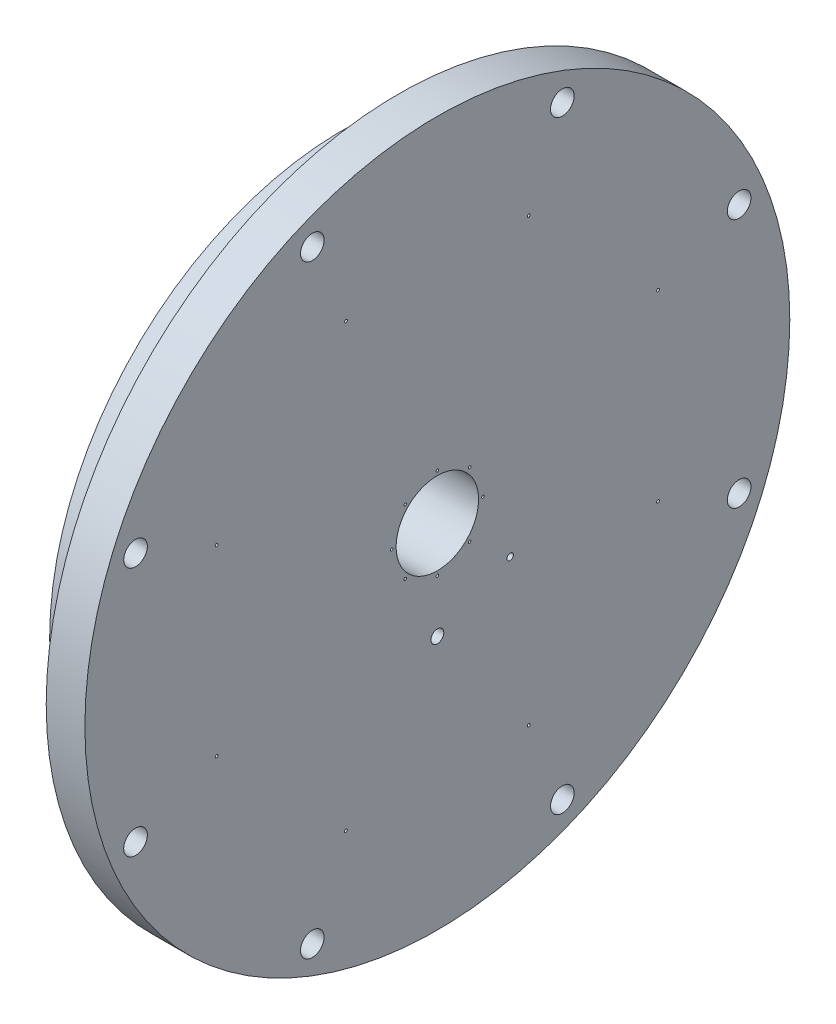
from build123d import *

# Parameters (mm, degrees)
FUEL_RING_SKETCH_W                = 6.7
FUEL_RING_SKETCH_H                = 2.5
CORE_MANIFOLD_SKETCH_W            = 6.7
CORE_MANIFOLD_SKETCH_H            = 1.6
FILM_MANIFOLD_SKETCH_W            = 2.8
FILM_MANIFOLD_SKETCH_H            = 1.5
PINTLE_SEAL_GROOVE_SKETCH_W       = 1.3
PINTLE_SEAL_GROOVE_SKETCH_H       = 2.4
FEED_PASSAGE_SKETCH_W             = 1.5
FEED_PASSAGE_SKETCH_H             = 48.905135707
FEED_PASSAGES_X3_COUNT            = 3
ETHANOL_HOLE_SKETCH_R             = 0.303840419
ETHANOL_HOLE_DEPTH                = 1.8
ETHANOL_HOLES_X8_COUNT            = 8
FILM_HOLE_SKETCH_R                = 0.333416852
FILM_HOLE_DEPTH                   = 1.8
FILM_HOLES_X8_COUNT               = 8
BOLT_HOLE_SKETCH_R                = 2.75
BOLT_HOLE_DEPTH                   = 9
BOLT_HOLES_X8_COUNT               = 8
IGNITER_PORT_4_ORB_SKETCH_R       = 4.953
IGNITER_PORT_4_ORB_DEPTH          = 10.5
IGNITER_PASSAGE_SKETCH_R          = 1.5
IGNITER_PASSAGE_DEPTH             = 22.5
PC_TAP_PORT_4_ORB_SKETCH_R        = 4.953
PC_TAP_PORT_4_ORB_DEPTH           = 10.5
PC_TAP_PASSAGE_SKETCH_R           = 0.75
PC_TAP_PASSAGE_DEPTH              = 22.5
ETHANOL_INLET_PORT_4_ORB_SKETCH_R = 4.953
ETHANOL_INLET_PORT_4_ORB_DEPTH    = 10.5
ETHANOL_INLET_PASSAGE_SKETCH_R    = 2
ETHANOL_INLET_PASSAGE_DEPTH       = 15.2
FILM_RESTRICTOR_SKETCH_R          = 0.434454496
FILM_RESTRICTOR_DEPTH             = 18.16
PINTLE_BOLT_TAP_DRILL_M4_SKETCH_R = 1.65
PINTLE_BOLT_TAP_DRILL_M4_DEPTH    = 10
PINTLE_BOLT_HOLES_X2_COUNT        = 2
TORCH_ETHANOL_PORT_SKETCH_R       = 3.5
TORCH_ETHANOL_PORT_DEPTH          = 8.6
TORCH_ETHANOL_DRILLING_SKETCH_R   = 1
TORCH_ETHANOL_DRILLING_DEPTH      = 15.2


with BuildPart() as part:
    # Body Sketch → Body (revolve)
    with BuildSketch(Plane.XY, mode=Mode.PRIVATE) as body_sk:
        Polygon((0, 9.594864293), (0, 82), (-9, 82), (-9, 68.2), (-22, 68.2), (-22, 9.594864293), align=None)
    revolve(body_sk.sketch.rotate(Axis((-60, 0, 0), (1, 0, 0)), 90), axis=Axis((-60, 0, 0), (1, 0, 0)))

    # Fuel Ring Sketch → Fuel Ring (revolve, cut)
    with BuildSketch(Plane.XY, mode=Mode.PRIVATE) as fuel_ring_sk:
        with Locations((-4.95, 59.9)):
            Rectangle(FUEL_RING_SKETCH_W, FUEL_RING_SKETCH_H)
    revolve(fuel_ring_sk.sketch.rotate(Axis((-60, 0, 0), (1, 0, 0)), 90), axis=Axis((-60, 0, 0), (1, 0, 0)), mode=Mode.SUBTRACT)

    # Core Manifold Sketch → Core Manifold (revolve, cut)
    with BuildSketch(Plane.XY, mode=Mode.PRIVATE) as core_manifold_sk:
        with Locations((-4.95, 10.994864293)):
            Rectangle(CORE_MANIFOLD_SKETCH_W, CORE_MANIFOLD_SKETCH_H)
    revolve(core_manifold_sk.sketch.rotate(Axis((-60, 0, 0), (1, 0, 0)), 90), axis=Axis((-60, 0, 0), (1, 0, 0)), mode=Mode.SUBTRACT)

    # Film Manifold Sketch → Film Manifold (revolve, cut)
    with BuildSketch(Plane.XY, mode=Mode.PRIVATE) as film_manifold_sk:
        with Locations((-3, 55.56918576)):
            Rectangle(FILM_MANIFOLD_SKETCH_W, FILM_MANIFOLD_SKETCH_H)
    revolve(film_manifold_sk.sketch.rotate(Axis((-60, 0, 0), (1, 0, 0)), 90), axis=Axis((-60, 0, 0), (1, 0, 0)), mode=Mode.SUBTRACT)

    # Pintle Seal Groove Sketch → Pintle Seal Groove (revolve, cut)
    with BuildSketch(Plane.XY, mode=Mode.PRIVATE) as pintle_seal_groove_sk:
        with Locations((-21.35, 12.4)):
            Rectangle(PINTLE_SEAL_GROOVE_SKETCH_W, PINTLE_SEAL_GROOVE_SKETCH_H)
    revolve(pintle_seal_groove_sk.sketch.rotate(Axis((-60, 0, 0), (1, 0, 0)), 90), axis=Axis((-60, 0, 0), (1, 0, 0)), mode=Mode.SUBTRACT)

    # Feed Passage Sketch → Feed Passage (revolve, cut)
    with BuildSketch(Plane.XY, mode=Mode.PRIVATE) as feed_passage_sk:
        with Locations((-6.05, 35.447432147)):
            Rectangle(FEED_PASSAGE_SKETCH_W, FEED_PASSAGE_SKETCH_H)
    feed_passage = revolve(feed_passage_sk.sketch.rotate(Axis((-6.8, 0, 0), (0, 1, 0)), 180), axis=Axis((-6.8, 0, 0), (0, 1, 0)), mode=Mode.SUBTRACT)

    # Feed Passages x3: Feed Passage ×3 about axis
    feed_passages_x3_axis = Axis((1.1, 0, 0), (-1, 0, 0))
    for i in range(1, FEED_PASSAGES_X3_COUNT):
        add(feed_passage.rotate(feed_passages_x3_axis, i * 360 / FEED_PASSAGES_X3_COUNT), mode=Mode.SUBTRACT)

    # Ethanol Hole Sketch → Ethanol Hole (cut)
    with BuildSketch(Plane(origin=(0, 0, 0), x_dir=(0, 0, -1), z_dir=(1, 0, 0))):
        with Locations((0, 10.598704712)):
            Circle(ETHANOL_HOLE_SKETCH_R)
    ethanol_hole = extrude(amount=-ETHANOL_HOLE_DEPTH, mode=Mode.SUBTRACT)

    # Ethanol Holes x8: Ethanol Hole ×8 about axis
    ethanol_holes_x8_axis = Axis((0, 0, 0), (1, 0, 0))
    for i in range(1, ETHANOL_HOLES_X8_COUNT):
        add(ethanol_hole.rotate(ethanol_holes_x8_axis, i * 360 / ETHANOL_HOLES_X8_COUNT), mode=Mode.SUBTRACT)

    # Film Hole Sketch → Film Hole (cut)
    with BuildSketch(Plane(origin=(0, 0, 0), x_dir=(0, 0, -1), z_dir=(1, 0, 0))):
        with Locations((21.26540674, 51.339233362)):
            Circle(FILM_HOLE_SKETCH_R)
    film_hole = extrude(amount=-FILM_HOLE_DEPTH, mode=Mode.SUBTRACT)

    # Film Holes x8: Film Hole ×8 about axis
    film_holes_x8_axis = Axis((0, 0, 0), (1, 0, 0))
    for i in range(1, FILM_HOLES_X8_COUNT):
        add(film_hole.rotate(film_holes_x8_axis, i * 360 / FILM_HOLES_X8_COUNT), mode=Mode.SUBTRACT)

    # Bolt Hole Sketch → Bolt Hole (cut)
    with BuildSketch(Plane(origin=(0, 0, 0), x_dir=(0, 0, -1), z_dir=(1, 0, 0))):
        with Locations((29.08394086, 70.214844471)):
            Circle(BOLT_HOLE_SKETCH_R)
    bolt_hole = extrude(amount=-BOLT_HOLE_DEPTH, mode=Mode.SUBTRACT)

    # Bolt Holes x8: Bolt Hole ×8 about axis
    bolt_holes_x8_axis = Axis((0, 0, 0), (1, 0, 0))
    for i in range(1, BOLT_HOLES_X8_COUNT):
        add(bolt_hole.rotate(bolt_holes_x8_axis, i * 360 / BOLT_HOLES_X8_COUNT), mode=Mode.SUBTRACT)

    # Igniter Port (-4 ORB) Sketch → Igniter Port (-4 ORB) (cut)
    with BuildSketch(Plane(origin=(-22, 0, 0), x_dir=(0, 0, -1), z_dir=(1, 0, 0))):
        with Locations(Location((0, -22.8, 0), (0, 0, 180))):
            Circle(IGNITER_PORT_4_ORB_SKETCH_R)
    extrude(amount=IGNITER_PORT_4_ORB_DEPTH, mode=Mode.SUBTRACT)

    # Igniter Passage Sketch → Igniter Passage (cut)
    with BuildSketch(Plane(origin=(-22, 0, 0), x_dir=(0, 0, -1), z_dir=(1, 0, 0))):
        with Locations(Location((0, -22.8, 0), (0, 0, 180))):
            Circle(IGNITER_PASSAGE_SKETCH_R)
    extrude(amount=IGNITER_PASSAGE_DEPTH, mode=Mode.SUBTRACT)

    # Pc Tap Port (-4 ORB) Sketch → Pc Tap Port (-4 ORB) (cut)
    with BuildSketch(Plane(origin=(-22, 0, 0), x_dir=(0, 0, -1), z_dir=(1, 0, 0))):
        with Locations(Location((16.943702021, -15.256177825, 0), (0, 0, 180))):
            Circle(PC_TAP_PORT_4_ORB_SKETCH_R)
    extrude(amount=PC_TAP_PORT_4_ORB_DEPTH, mode=Mode.SUBTRACT)

    # Pc Tap Passage Sketch → Pc Tap Passage (cut)
    with BuildSketch(Plane(origin=(-22, 0, 0), x_dir=(0, 0, -1), z_dir=(1, 0, 0))):
        with Locations(Location((16.943702021, -15.256177825, 0), (0, 0, 180))):
            Circle(PC_TAP_PASSAGE_SKETCH_R)
    extrude(amount=PC_TAP_PASSAGE_DEPTH, mode=Mode.SUBTRACT)

    # Ethanol Inlet Port (-4 ORB) Sketch → Ethanol Inlet Port (-4 ORB) (cut)
    with BuildSketch(Plane(origin=(-22, 0, 0), x_dir=(0, 0, -1), z_dir=(1, 0, 0))):
        with Locations(Location((0, 55.56918576, 0), (0, 0, 180))):
            Circle(ETHANOL_INLET_PORT_4_ORB_SKETCH_R)
    extrude(amount=ETHANOL_INLET_PORT_4_ORB_DEPTH, mode=Mode.SUBTRACT)

    # Ethanol Inlet Passage Sketch → Ethanol Inlet Passage (cut)
    with BuildSketch(Plane(origin=(-22, 0, 0), x_dir=(0, 0, -1), z_dir=(1, 0, 0))):
        with Locations(Location((0, 55.56918576, 0), (0, 0, 221.409622109))):
            Circle(ETHANOL_INLET_PASSAGE_SKETCH_R)
    extrude(amount=ETHANOL_INLET_PASSAGE_DEPTH, mode=Mode.SUBTRACT)

    # Film Restrictor Sketch → Film Restrictor (cut)
    with BuildSketch(Plane(origin=(-22, 0, 0), x_dir=(0, 0, -1), z_dir=(1, 0, 0))):
        with Locations(Location((0, 55.56918576, 0), (0, 0, 180))):
            Circle(FILM_RESTRICTOR_SKETCH_R)
    extrude(amount=FILM_RESTRICTOR_DEPTH, mode=Mode.SUBTRACT)

    # Pintle Bolt Tap Drill (M4) Sketch → Pintle Bolt Tap Drill (M4) (cut)
    with BuildSketch(Plane(origin=(-22, 0, 0), x_dir=(0, 0, -1), z_dir=(1, 0, 0))):
        with Locations((19, 0)):
            Circle(PINTLE_BOLT_TAP_DRILL_M4_SKETCH_R)
    pintle_bolt_tap_drill_m4 = extrude(amount=PINTLE_BOLT_TAP_DRILL_M4_DEPTH, mode=Mode.SUBTRACT)

    # Pintle Bolt Holes x2: Pintle Bolt Tap Drill (M4) ×2 about axis
    pintle_bolt_holes_x2_axis = Axis((0, 0, 0), (1, 0, 0))
    for i in range(1, PINTLE_BOLT_HOLES_X2_COUNT):
        add(pintle_bolt_tap_drill_m4.rotate(pintle_bolt_holes_x2_axis, i * 360 / PINTLE_BOLT_HOLES_X2_COUNT), mode=Mode.SUBTRACT)

    # Torch Ethanol Port Sketch → Torch Ethanol Port (cut)
    with BuildSketch(Plane(origin=(-22, 0, 0), x_dir=(0, 0, -1), z_dir=(1, 0, 0))):
        with Locations(Location((-22.516660498, -13, 0), (0, 0, 180))):
            Circle(TORCH_ETHANOL_PORT_SKETCH_R)
    extrude(amount=TORCH_ETHANOL_PORT_DEPTH, mode=Mode.SUBTRACT)

    # Torch Ethanol Drilling Sketch → Torch Ethanol Drilling (cut)
    with BuildSketch(Plane(origin=(-22, 0, 0), x_dir=(0, 0, -1), z_dir=(1, 0, 0))):
        with Locations(Location((-22.516660498, -13, 0), (0, 0, 180))):
            Circle(TORCH_ETHANOL_DRILLING_SKETCH_R)
    extrude(amount=TORCH_ETHANOL_DRILLING_DEPTH, mode=Mode.SUBTRACT)


solid = part.part
